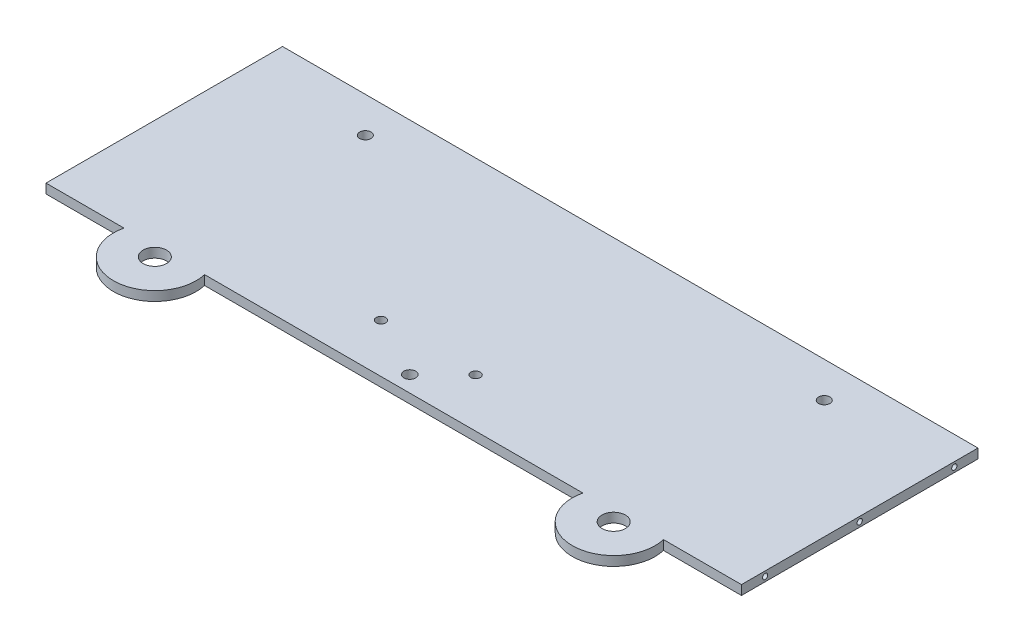
from build123d import *

# Parameters (mm, degrees)
BOSS_EXTRUDE1_DEPTH     = 5.07492
SKETCH1_5_R             = 6.2865
CUT_EXTRUDE1_DEPTH      = 208.664293845
CUT_EXTRUDE2_DEPTH      = 208.664293845
CUT_EXTRUDE2_DEPTH_BACK = 208.664293845
SKETCH1_7_R             = 3.048
SKETCH1_8_R             = 2.54
SKETCH1_8_R_2           = 3.175
CUT_EXTRUDE3_DEPTH      = 208.664293845
SKETCH2_R               = 1.4224
CUT_EXTRUDE4_DEPTH      = 12.7
CUT_EXTRUDE5_START      = -12.7
SKETCH3_R               = 1.4224
CUT_EXTRUDE5_DEPTH      = 12.7


with BuildPart() as part:
    # Sketch1 → Boss-Extrude1 (new body)
    with BuildSketch(Plane(origin=(0, 0, 0), x_dir=(1, 0, 0), z_dir=(0, 1, 0))):
        with BuildLine():
            Line((-186.69, 63.5), (-186.69, -63.5))
            Line((-186.69, -63.5), (-144.826640797, -63.5))
            ThreePointArc((-144.826640797, -63.5), (-123.19, -90.805), (-101.553359203, -63.5))
            Line((-101.553359203, -63.5), (101.553359203, -63.5))
            ThreePointArc((101.553359203, -63.5), (123.19, -90.805), (144.826640797, -63.5))
            Line((144.826640797, -63.5), (186.69, -63.5))
            Line((186.69, -63.5), (186.69, 63.5))
            Line((186.69, 63.5), (-186.69, 63.5))
        make_face()
    extrude(amount=BOSS_EXTRUDE1_DEPTH)

    # Sketch1<5> → Cut-Extrude1 (cut, through all)
    with BuildSketch(Plane(origin=(0, 0, 0), x_dir=(1, 0, 0), z_dir=(0, 1, 0))):
        with Locations((-123.19, -68.58)):
            Circle(SKETCH1_5_R)
        with Locations((123.19, -68.58)):
            Circle(SKETCH1_5_R)
    extrude(amount=CUT_EXTRUDE1_DEPTH, mode=Mode.SUBTRACT)

    # Sketch1<7> → Cut-Extrude2 (cut, two sides: drawn at the far end of the back side and taken through both)
    with BuildSketch(Plane(origin=(0, 0, 0), x_dir=(1, 0, 0), z_dir=(0, 1, 0)).offset(-CUT_EXTRUDE2_DEPTH_BACK)):
        with Locations((-123.19, 44.45)):
            Circle(SKETCH1_7_R)
        with Locations((123.19, 44.45)):
            Circle(SKETCH1_7_R)
    extrude(amount=CUT_EXTRUDE2_DEPTH + CUT_EXTRUDE2_DEPTH_BACK, mode=Mode.SUBTRACT)

    # Sketch1<8> → Cut-Extrude3 (cut, through all)
    with BuildSketch(Plane(origin=(0, 0, 0), x_dir=(1, 0, 0), z_dir=(0, 1, 0))):
        with Locations((-33.02, -37.338)):
            Circle(SKETCH1_8_R)
        with Locations((17.78, -37.338)):
            Circle(SKETCH1_8_R)
        with Locations((0, -54.864)):
            Circle(SKETCH1_8_R_2)
    extrude(amount=CUT_EXTRUDE3_DEPTH, mode=Mode.SUBTRACT)

    # Sketch2 → Cut-Extrude4 (cut)
    with BuildSketch(Plane(origin=(186.69, 0, 0), x_dir=(0, 0, -1), z_dir=(1, 0, 0))):
        with Locations((0, 2.53746)):
            Circle(SKETCH2_R)
        with Locations((-50.8, 2.53746)):
            Circle(SKETCH2_R)
        with Locations((50.8, 2.53746)):
            Circle(SKETCH2_R)
    extrude(amount=-CUT_EXTRUDE4_DEPTH, mode=Mode.SUBTRACT)

    # Sketch3 → Cut-Extrude5 (cut)
    with BuildSketch(Plane.ZY.offset(186.69).offset(CUT_EXTRUDE5_START)):
        with Locations((-50.8, 2.53746)):
            Circle(SKETCH3_R)
        with Locations((0, 2.53746)):
            Circle(SKETCH3_R)
    extrude(amount=CUT_EXTRUDE5_DEPTH, mode=Mode.SUBTRACT)


solid = part.part
